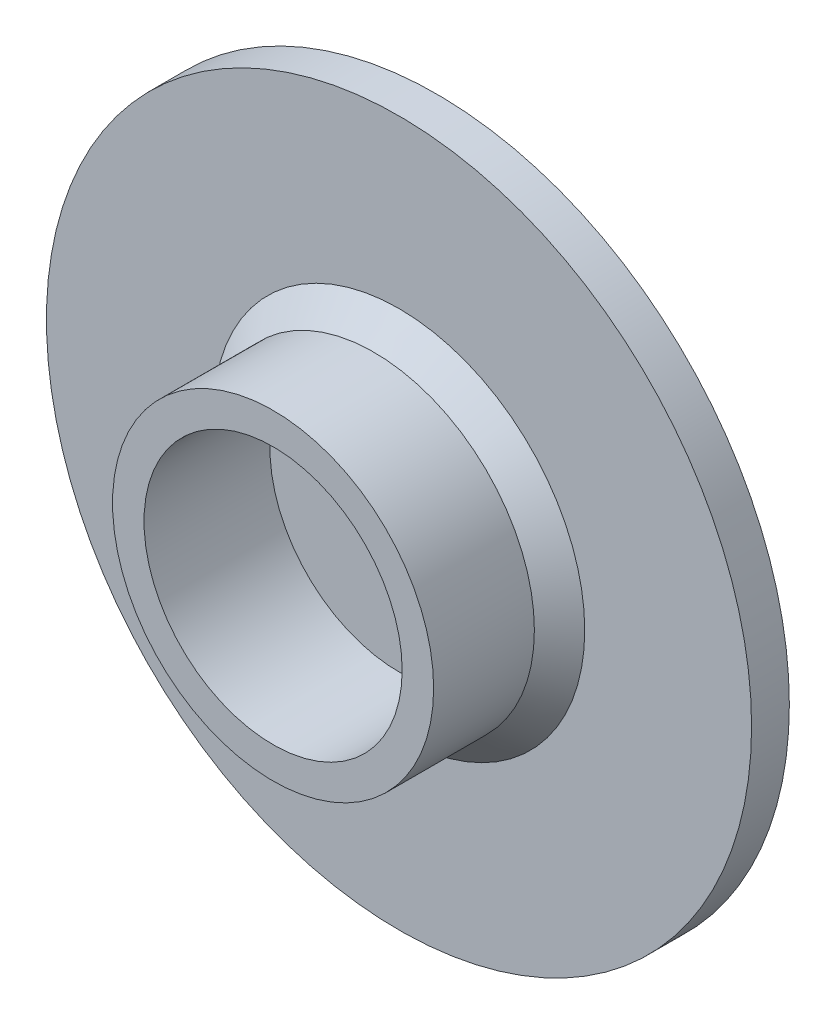
from build123d import *

# Parameters (mm, degrees)
ESQUISSE1_R                  = 28
BOSS_EXTRU_1_DEPTH           = 3
ENL_V_MAT_EXTRU_1_DEPTH      = 40.711459303
ENL_V_MAT_EXTRU_1_DEPTH_BACK = 40.711459303
ESQUISSE2_R                  = 3
ESQUISSE3_R                  = 12.75
ESQUISSE3_R_2                = 10.25
BOSS_EXTRU_2_DEPTH           = 10
CHANFREIN1_SIZE              = 2


with BuildPart() as part:
    # Esquisse1 → Boss.-Extru.1 (new body)
    with BuildSketch(Plane.XY):
        Circle(ESQUISSE1_R)
    extrude(amount=BOSS_EXTRU_1_DEPTH)

    # Esquisse2 → Enlèv. mat.-Extru.1 (cut, two sides: drawn at the far end of the back side and taken through both)
    with BuildSketch(Plane.XY.offset(3).offset(-ENL_V_MAT_EXTRU_1_DEPTH_BACK)):
        Circle(ESQUISSE2_R)
    extrude(amount=ENL_V_MAT_EXTRU_1_DEPTH + ENL_V_MAT_EXTRU_1_DEPTH_BACK, mode=Mode.SUBTRACT)

    # Esquisse3 → Boss.-Extru.2 (add)
    with BuildSketch(Plane.XY.offset(3)):
        Circle(ESQUISSE3_R)
        Circle(ESQUISSE3_R_2, mode=Mode.SUBTRACT)
    extrude(amount=BOSS_EXTRU_2_DEPTH)

    # Chanfrein1
    chanfrein1_edges = [part.edges().sort_by_distance(p)[0] for p in [
        (-12.75, 0, 3),
    ]]
    chamfer(chanfrein1_edges, length=CHANFREIN1_SIZE)


solid = part.part
